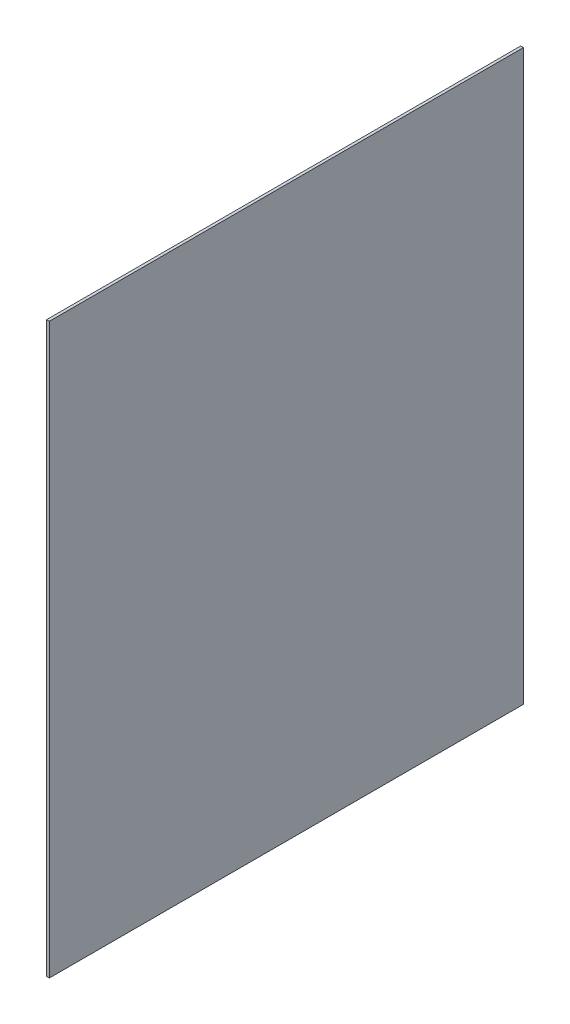
from build123d import *

# Parameters (mm, degrees)
BOSS_EXTRUDE1_START = -2150
SKETCH1_W           = 25
SKETCH1_H           = 5160.185431966
BOSS_EXTRUDE1_DEPTH = 4300


with BuildPart() as part:
    # Sketch1 → Boss-Extrude1 (new body)
    with BuildSketch(Plane.XY.offset(BOSS_EXTRUDE1_START)):
        Rectangle(SKETCH1_W, SKETCH1_H)
    extrude(amount=BOSS_EXTRUDE1_DEPTH)


solid = part.part
